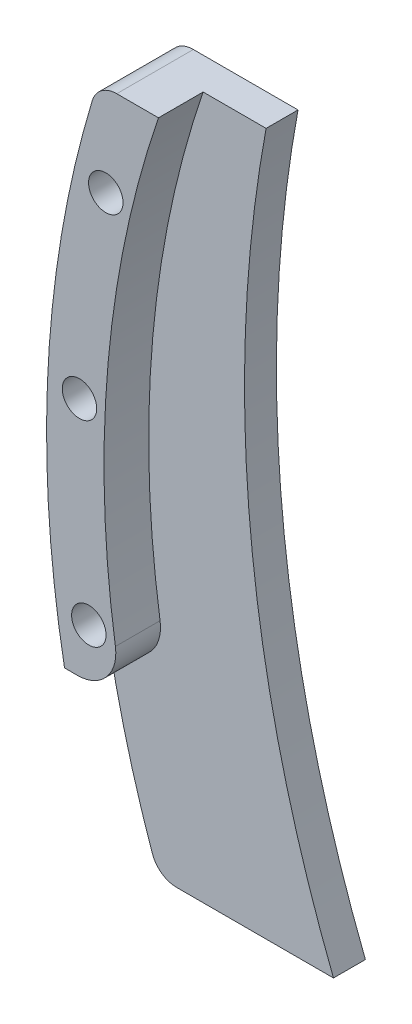
from build123d import *

# Parameters (mm, degrees)
SKETCH_1_R           = 3.5
EXTRUDE_1_DEPTH      = 3
SKETCH_2_R           = 1.5
CUT_EXTRUDE_1_DEPTH  = 10
EXTRUDE_2_DEPTH      = 4
EXTRUDE_5_DEPTH      = 7
FILLET_1_R           = 2
HOLE_WIZARD_M2_5_1_D = 2.05
SKETCH_12_R          = 1.025
EXTRUDE_6_DEPTH      = 5
EXTRUDE_7_DEPTH      = 2.5
CUT_EXTRUDE_START    = 2.5
SKETCH_14_W          = 65.294749478
SKETCH_14_H          = 102.548808998
CUT_EXTRUDE_2_DEPTH  = 93.634928881
CUT_EXTRUDE_3_DEPTH  = 2.5
SKETCH_16_R          = 1.35
CUT_EXTRUDE_4_DEPTH  = 10
EXTRUDE_START        = 1
SKETCH_17_R          = 1.35
EXTRUDE_8_DEPTH      = 1
FILLET_2_R           = 3


with BuildPart() as part:
    # 草图1 → 凸台-拉伸1 (new body)
    with BuildSketch(Plane.XY):
        with BuildLine():
            Line((0, 0), (17, 0))
            Line((17, 0), (17, 21))
            ThreePointArc((17, 21), (14.559389791, 26.961023013), (8.639106973, 29.498861644))
            ThreePointArc((8.639106973, 29.498861644), (4.214678609, 30.921411086), (1.327625741, 34.563407653))
            ThreePointArc((1.327625741, 34.563407653), (-5.234705957, 62.223549547), (-3.748501306, 90.612611571))
            ThreePointArc((-3.748501306, 90.612611571), (-5.162788524, 92.923505905), (-7.58241645, 91.704554856))
            ThreePointArc((-7.58241645, 91.704554856), (-12.196269834, 55.45091149), (0, 21))
            Line((0, 21), (0, 0))
        make_face()
        with Locations((8.5, 21)):
            Circle(SKETCH_1_R, mode=Mode.SUBTRACT)
    extrude(amount=EXTRUDE_1_DEPTH)

    # 草图2 → 切除-拉伸1 (cut)
    with BuildSketch(Plane(origin=(0, 0, 0), x_dir=(-1, 0, 0), z_dir=(0, 0, -1))):
        with Locations((-14, 4)):
            Circle(SKETCH_2_R)
        with Locations(Location((-3, 4, 0), (0, 0, 180))):
            Circle(SKETCH_2_R)
    extrude(amount=-CUT_EXTRUDE_1_DEPTH, mode=Mode.SUBTRACT)

    # 草图3 → 凸台-拉伸2 (add)
    with BuildSketch(Plane.XY.offset(3)):
        with BuildLine():
            ThreePointArc((-7.58241645, 91.704554856), (-12.6426678, 63.080202535), (-7.007767698, 34.563407653))
            Line((-7.007767698, 34.563407653), (1.327625741, 34.563407653))
            ThreePointArc((1.327625741, 34.563407653), (-5.234705957, 62.223549547), (-3.748501306, 90.612611571))
            ThreePointArc((-3.748501306, 90.612611571), (-5.162788524, 92.923505905), (-7.58241645, 91.704554856))
        make_face()
    extrude(amount=EXTRUDE_2_DEPTH)

    # 草图8 → 凸台-拉伸5 (add)
    with BuildSketch(Plane(origin=(0, 0, 0), x_dir=(-1, 0, 0), z_dir=(0, 0, -1))):
        with BuildLine():
            Line((8.353336216, 89.563407653), (13.622203114, 89.563407653))
            ThreePointArc((13.622203114, 89.563407653), (17.624786926, 61.957713987), (12.366747323, 34.563407653))
            Line((12.366747323, 34.563407653), (7.007767698, 34.563407653))
            ThreePointArc((7.007767698, 34.563407653), (12.623031035, 61.942490485), (8.353336216, 89.563407653))
        make_face()
    extrude(amount=-EXTRUDE_5_DEPTH)

    # 圆角1
    fillet_1_edges = [part.edges().sort_by_distance(p)[0] for p in [
        (-12.366747323, 34.563407653, 3.5),
        (-13.622203114, 89.563407653, 3.5),
        (-8.353336216, 89.563407653, 3.5),
        (-7.007767698, 34.563407653, 1.5),
    ]]
    fillet(fillet_1_edges, radius=FILLET_1_R)

    # M2.5 螺纹孔1 (through all)
    with Locations(Plane(origin=(0, 0, 0), x_dir=(-1, 0, 0), z_dir=(0, 0, -1))):
        with Locations((14.33753876, 52.418963936), (-20.3596947, 65.689324708), (13.008857265, 82.418963936), (15.069556912, 67.418963936)):
            Hole(HOLE_WIZARD_M2_5_1_D / 2)

    # 草图12 → 凸台-拉伸6 (add)
    with BuildSketch(Plane(origin=(0, 0, 0), x_dir=(-1, 0, 0), z_dir=(0, 0, -1))):
        with BuildLine():
            Line((7.545930127, 34.563407653), (8.350121818, 34.563407653))
            Line((8.350121818, 34.563407653), (10.964814809, 34.563407653))
            ThreePointArc((10.964814809, 34.563407653), (12.119748759, 34.930579564), (12.850623405, 35.897280083))
            ThreePointArc((12.850623405, 35.897280083), (17.623972952, 61.922380585), (14.065160369, 88.141182522))
            ThreePointArc((14.065160369, 88.141182522), (13.343005034, 89.168952691), (12.150434226, 89.563407653))
            Line((12.150434226, 89.563407653), (9.767172344, 89.563407653))
            Line((9.767172344, 89.563407653), (8.88187432, 89.563407653))
            ThreePointArc((8.88187432, 89.563407653), (13.123220294, 61.944160836), (7.545930127, 34.563407653))
        make_face()
        with Locations((14.33753876, 52.418963936)):
            Circle(SKETCH_12_R, mode=Mode.SUBTRACT)
        with Locations((15.069556912, 67.418963936)):
            Circle(SKETCH_12_R, mode=Mode.SUBTRACT)
        with Locations((13.008857265, 82.418963936)):
            Circle(SKETCH_12_R, mode=Mode.SUBTRACT)
    extrude(amount=EXTRUDE_6_DEPTH)

    # 草图13 → 凸台-拉伸7 (add)
    with BuildSketch(Plane(origin=(0, 0, -5), x_dir=(-1, 0, 0), z_dir=(0, 0, -1))):
        with BuildLine():
            Line((-1.327625741, 34.563407653), (7.545930127, 34.563407653))
            ThreePointArc((7.545930127, 34.563407653), (13.123220294, 61.944160836), (8.88187432, 89.563407653))
            Line((8.88187432, 89.563407653), (3.949832031, 89.563407653))
            ThreePointArc((3.949832031, 89.563407653), (5.185104579, 61.691682581), (-1.327625741, 34.563407653))
        make_face()
    extrude(amount=-EXTRUDE_7_DEPTH)

    # 草图14 → 切除-拉伸2 (cut, through all)
    with BuildSketch(Plane.XY.offset(-2.5).offset(CUT_EXTRUDE_START)):
        with Locations((4.683934874, 45.498546787)):
            Rectangle(SKETCH_14_W, SKETCH_14_H)
    extrude(amount=CUT_EXTRUDE_2_DEPTH, mode=Mode.SUBTRACT)

    # 草图15 → 切除-拉伸3 (cut)
    with BuildSketch(Plane.XY.offset(-2.5).offset(CUT_EXTRUDE_START)):
        with BuildLine():
            Line((-11.658303974, 48.563407653), (-16.239435818, 48.563407653))
            ThreePointArc((-16.239435818, 48.563407653), (-14.792540388, 42.164122556), (-12.850623405, 35.897280083))
            ThreePointArc((-12.850623405, 35.897280083), (-12.119748759, 34.930579564), (-10.964814809, 34.563407653))
            Line((-10.964814809, 34.563407653), (-7.545930127, 34.563407653))
            ThreePointArc((-7.545930127, 34.563407653), (-9.923992526, 41.468859633), (-11.658303974, 48.563407653))
        make_face()
    extrude(amount=-CUT_EXTRUDE_3_DEPTH, mode=Mode.SUBTRACT)

    # 草图16 → 切除-拉伸4 (cut)
    with BuildSketch(Plane.XY):
        with Locations((-13.008857265, 82.418963936)):
            Circle(SKETCH_16_R)
        with Locations((-15.069556912, 67.418963936)):
            Circle(SKETCH_16_R)
        with Locations((-14.33753876, 52.418963936)):
            Circle(SKETCH_16_R)
    extrude(amount=-CUT_EXTRUDE_4_DEPTH, mode=Mode.SUBTRACT)

    # 草图17 → 凸台-拉伸8 (add)
    with BuildSketch(Plane.XY.offset(EXTRUDE_START)):
        with BuildLine():
            Line((-16.239435818, 48.563407653), (-11.658303974, 48.563407653))
            ThreePointArc((-11.658303974, 48.563407653), (-12.965005338, 69.245901439), (-8.88187432, 89.563407653))
            Line((-8.88187432, 89.563407653), (-12.150434226, 89.563407653))
            ThreePointArc((-12.150434226, 89.563407653), (-13.343005034, 89.168952691), (-14.065160369, 88.141182522))
            ThreePointArc((-14.065160369, 88.141182522), (-17.520190498, 68.482379468), (-16.239435818, 48.563407653))
        make_face()
        with Locations((-14.33753876, 52.418963936)):
            Circle(SKETCH_17_R, mode=Mode.SUBTRACT)
        with Locations((-15.069556912, 67.418963936)):
            Circle(SKETCH_17_R, mode=Mode.SUBTRACT)
        with Locations((-13.008857265, 82.418963936)):
            Circle(SKETCH_17_R, mode=Mode.SUBTRACT)
    extrude(amount=-EXTRUDE_8_DEPTH)

    # 圆角2
    fillet_2_edges = [part.edges().sort_by_distance(p)[0] for p in [
        (-11.658303974, 48.563407653, -0.75),
    ]]
    fillet(fillet_2_edges, radius=FILLET_2_R)


solid = part.part
